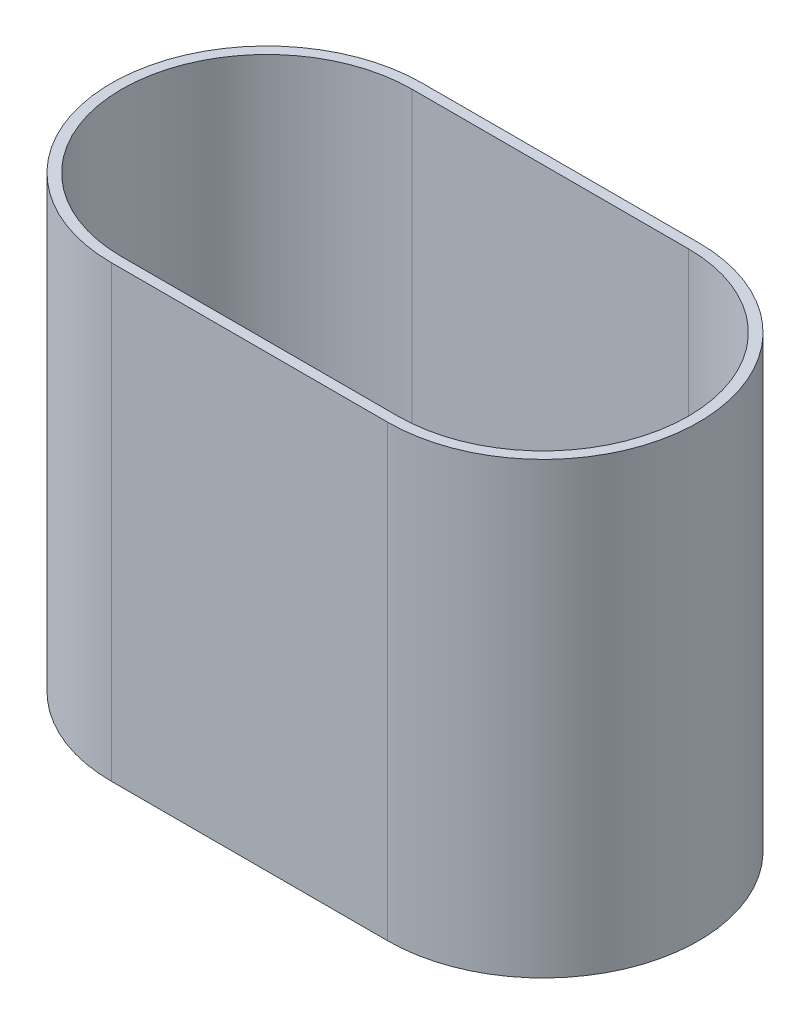
from build123d import *

# Parameters (mm, degrees)
BOSS_EXTRUDE1_DEPTH = 130
SHELL1_T            = -3


with BuildPart() as part:
    # Sketch1 → Boss-Extrude1 (new body)
    with BuildSketch(Plane(origin=(0, 0, 0), x_dir=(1, 0, 0), z_dir=(0, 1, 0))):
        with BuildLine():
            Line((-40, -45), (40, -45))
            ThreePointArc((40, -45), (85, 0), (40, 45))
            Line((40, 45), (-40, 45))
            ThreePointArc((-40, 45), (-85, 0), (-40, -45))
        make_face()
    extrude(amount=BOSS_EXTRUDE1_DEPTH)

    # Shell1
    shell1_openings = [part.faces().sort_by_distance(p)[0] for p in [
        (0, 130, 0),
        (0, 0, 0),
    ]]
    offset(amount=SHELL1_T, openings=shell1_openings, kind=Kind.INTERSECTION)


solid = part.part
